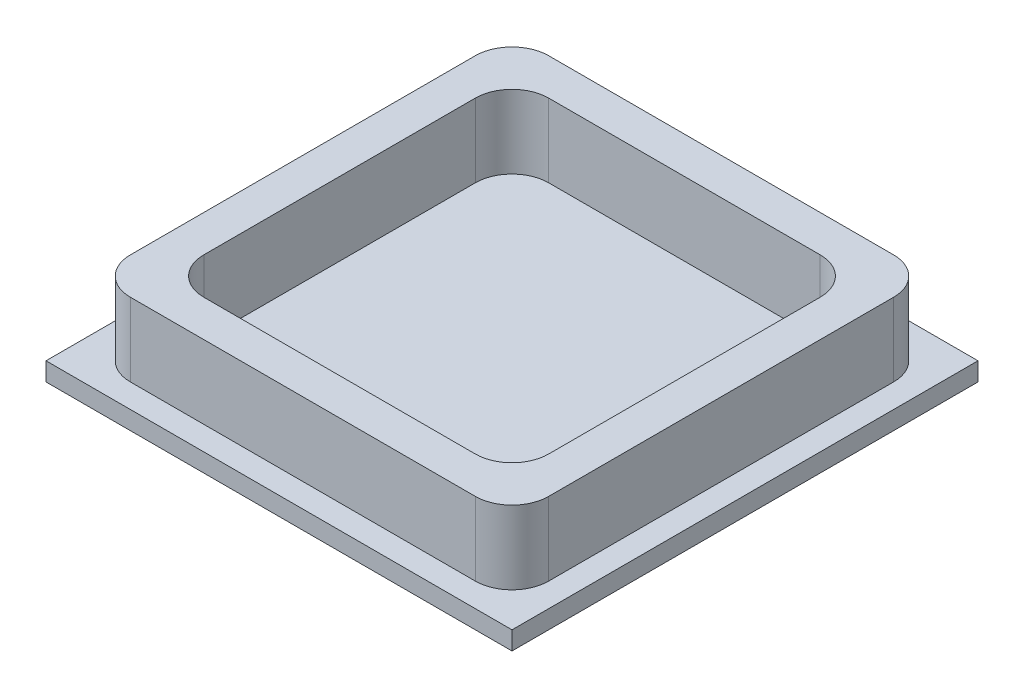
from build123d import *

# Parameters (mm, degrees)
SKETCH1_W           = 25.4
SKETCH1_H           = 25.4
BOSS_EXTRUDE1_DEPTH = 1
SKETCH2_W           = 22.8
SKETCH2_H           = 22.8
SKETCH2_W_2         = 18.8
SKETCH2_H_2         = 18.8
BOSS_EXTRUDE2_DEPTH = 4
FILLET1_R           = 2


with BuildPart() as part:
    # Sketch1 → Boss-Extrude1 (new body)
    with BuildSketch(Plane(origin=(0, 0, 0), x_dir=(1, 0, 0), z_dir=(0, 1, 0))):
        Rectangle(SKETCH1_W, SKETCH1_H)
    extrude(amount=BOSS_EXTRUDE1_DEPTH)

    # Sketch2 → Boss-Extrude2 (add)
    with BuildSketch(Plane(origin=(0, 1, 0), x_dir=(1, 0, 0), z_dir=(0, 1, 0))):
        Rectangle(SKETCH2_W, SKETCH2_H)
        Rectangle(SKETCH2_W_2, SKETCH2_H_2, mode=Mode.SUBTRACT)
    extrude(amount=BOSS_EXTRUDE2_DEPTH)

    # Fillet1
    fillet1_edges = [part.edges().sort_by_distance(p)[0] for p in [
        (11.4, 3, 11.4),
        (11.4, 3, -11.4),
        (-11.4, 3, -11.4),
        (-11.4, 3, 11.4),
        (-9.4, 3, -9.4),
        (-9.4, 3, 9.4),
        (9.4, 3, 9.4),
        (9.4, 3, -9.4),
    ]]
    fillet(fillet1_edges, radius=FILLET1_R)


solid = part.part
